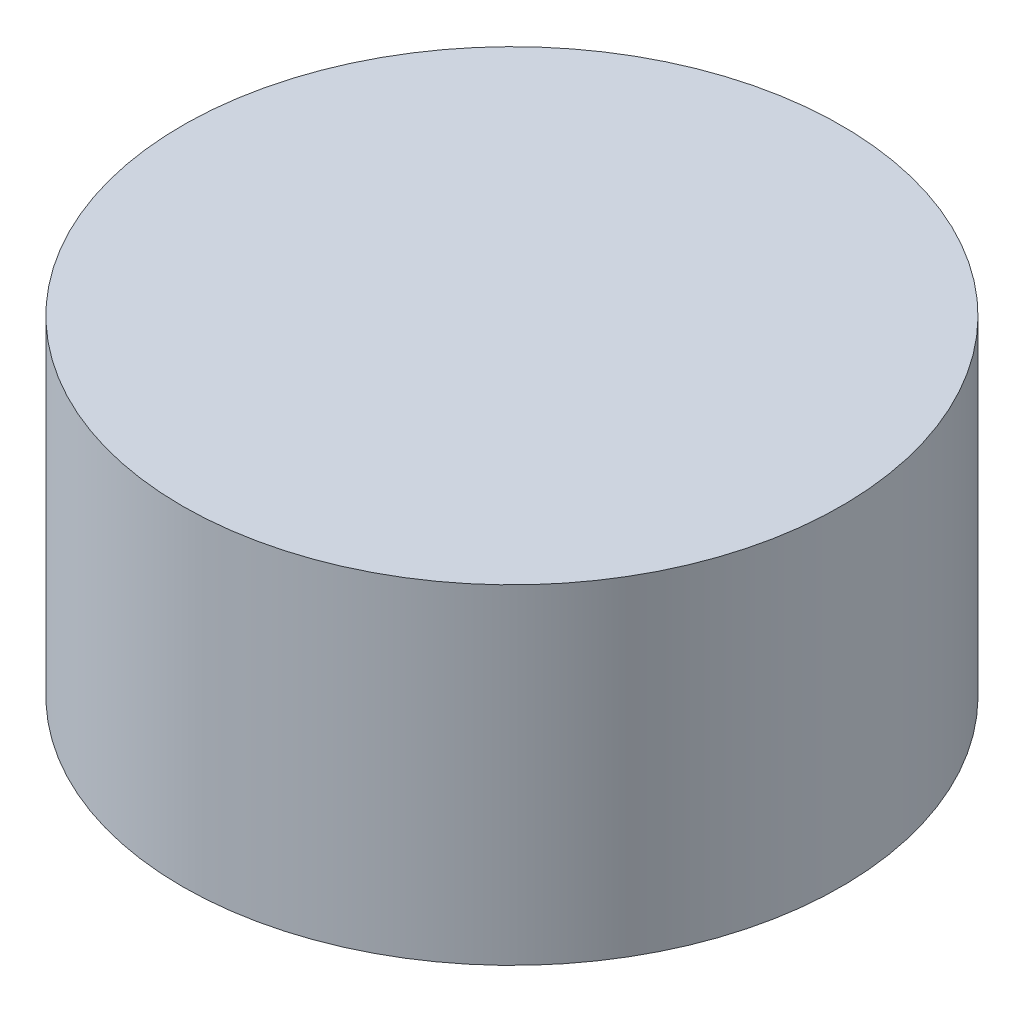
from build123d import *

# Parameters (mm, degrees)
SKETCH1_W           = 50
SKETCH1_H           = 25
BOSS_EXTRUDE1_DEPTH = 25
FILLET2_R           = 5
CUT_EXTRUDE1_DEPTH  = 15
SKETCH3_R           = 50
BOSS_EXTRUDE2_DEPTH = 50
SKETCH4_R           = 30
CUT_EXTRUDE2_DEPTH  = 30


with BuildPart() as part:
    # Sketch1 → Boss-Extrude1 (new body)
    with BuildSketch(Plane(origin=(0, 0, 0), x_dir=(1, 0, 0), z_dir=(0, 1, 0))):
        Rectangle(SKETCH1_W, SKETCH1_H)
    extrude(amount=BOSS_EXTRUDE1_DEPTH)

    # Fillet2
    fillet2_edges = [part.edges().sort_by_distance(p)[0] for p in [
        (25, 12.5, 12.5),
        (-25, 12.5, 12.5),
        (-25, 12.5, -12.5),
        (25, 12.5, -12.5),
    ]]
    fillet(fillet2_edges, radius=FILLET2_R)

    # Sketch2 → Cut-Extrude1 (cut)
    with BuildSketch(Plane(origin=(0, 25, 0), x_dir=(1, 0, 0), z_dir=(0, 1, 0))):
        with BuildLine():
            Line((-13.058351702, 9.034247402), (13.06, 9.034247402))
            ThreePointArc((13.06, 9.034247402), (22.094247402, 0), (13.06, -9.034247402))
            Line((13.06, -9.034247402), (-13.058351702, -9.034247402))
            ThreePointArc((-13.058351702, -9.034247402), (-22.092599103, 0), (-13.058351702, 9.034247402))
        make_face()
    extrude(amount=-CUT_EXTRUDE1_DEPTH, mode=Mode.SUBTRACT)

    # Sketch3 → Boss-Extrude2 (add)
    with BuildSketch(Plane(origin=(0, 0, 0), x_dir=(1, 0, 0), z_dir=(0, 1, 0))):
        with Locations(Location((0, 0, 0), (0, 0, 270))):
            Circle(SKETCH3_R)
    extrude(amount=BOSS_EXTRUDE2_DEPTH)

    # Sketch4 → Cut-Extrude2 (cut)
    with BuildSketch(Plane.XZ):
        with Locations(Location((0, 0, 0), (0, 0, 270))):
            Circle(SKETCH4_R)
    extrude(amount=-CUT_EXTRUDE2_DEPTH, mode=Mode.SUBTRACT)


solid = part.part
